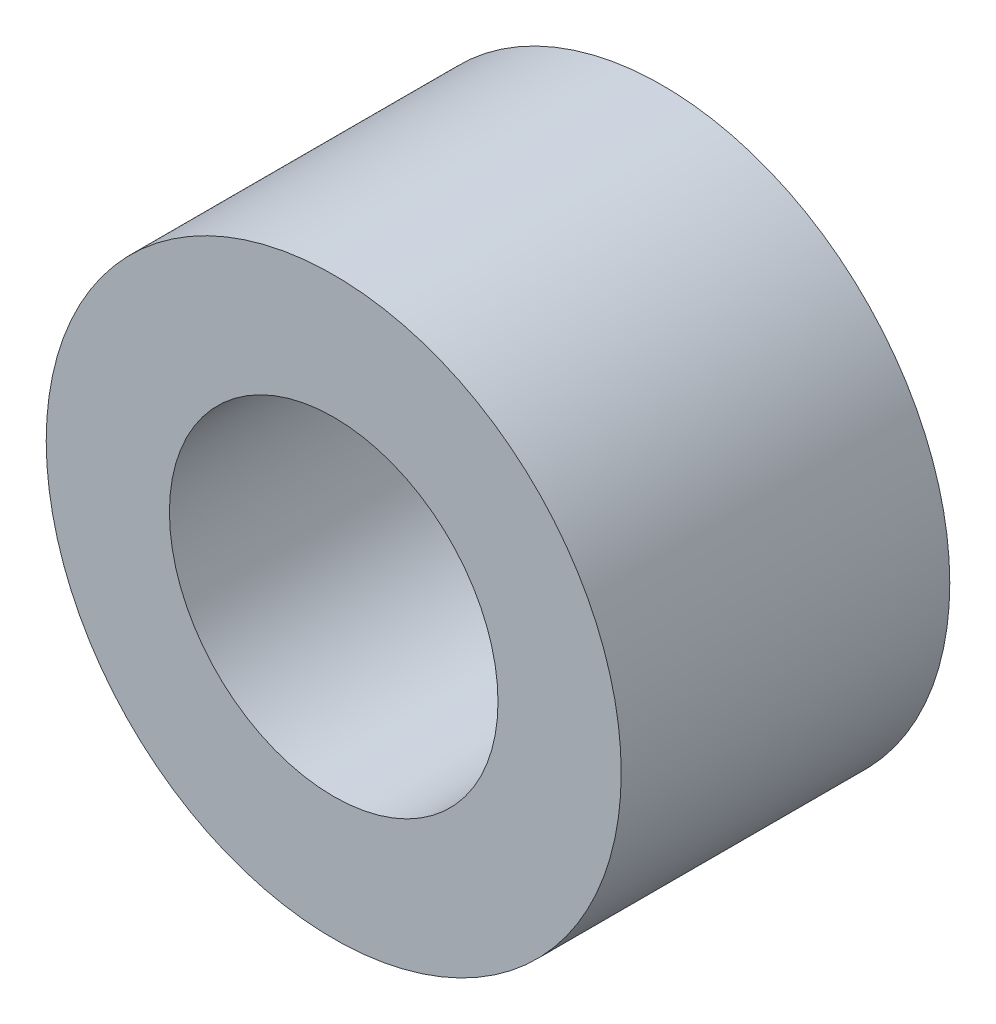
from build123d import *

# Parameters (mm, degrees)
SKETCH_1_R      = 3.5
SKETCH_1_R_2    = 2
EXTRUDE_1_DEPTH = 4


with BuildPart() as part:
    # 草图1 → 凸台-拉伸1 (new body)
    with BuildSketch(Plane.XY):
        Circle(SKETCH_1_R)
        Circle(SKETCH_1_R_2, mode=Mode.SUBTRACT)
    extrude(amount=EXTRUDE_1_DEPTH)


solid = part.part
